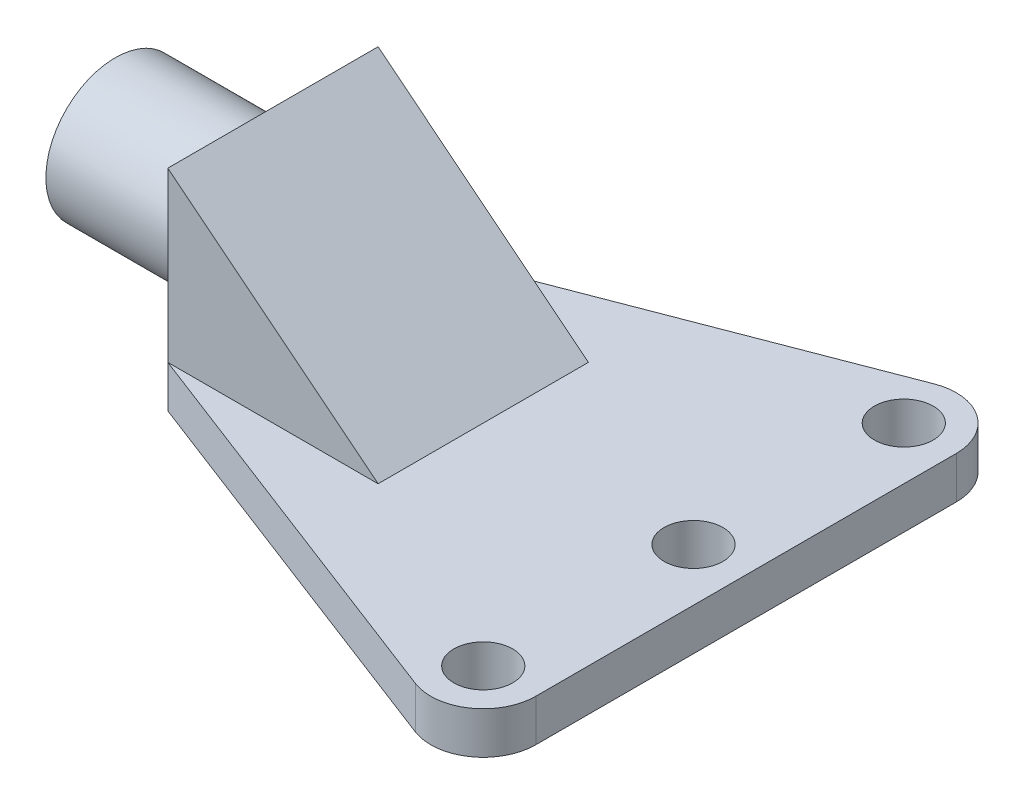
from build123d import *

# Parameters (mm, degrees)
SKETCH2_W           = 25.4
SKETCH2_H           = 25.4
BOSS_EXTRUDE1_DEPTH = 25.4
BOSS_EXTRUDE2_DEPTH = 5.08
SKETCH5_R           = 3.556
CUT_EXTRUDE1_DEPTH  = 5.08
SKETCH6_R           = 3.556
CUT_EXTRUDE2_DEPTH  = 5.08
CUT_EXTRUDE3_DEPTH  = 25.4
SKETCH10_R          = 8.382
BOSS_EXTRUDE3_DEPTH = 19.05
CUT_EXTRUDE4_REACH  = 82.822
SKETCH12_R          = 3.556


with BuildPart() as part:
    # Sketch2 → Boss-Extrude1 (new body)
    with BuildSketch(Plane(origin=(0, 0, 0), x_dir=(1, 0, 0), z_dir=(0, 1, 0))):
        with Locations((-38.1, 0)):
            Rectangle(SKETCH2_W, SKETCH2_H)
    extrude(amount=BOSS_EXTRUDE1_DEPTH)

    # Sketch8 → Cut-Extrude3 (cut)
    with BuildSketch(Plane(origin=(0, 0, -12.7), x_dir=(-1, 0, 0), z_dir=(0, 0, -1))):
        Polygon((50.8, 25.4), (25.4, 5.08), (25.4, 25.4), align=None)
    extrude(amount=-CUT_EXTRUDE3_DEPTH, mode=Mode.SUBTRACT)



with BuildPart() as body_2:
    # Sketch4 → Boss-Extrude2 (new body)
    with BuildSketch(Plane(origin=(0, 0, 0), x_dir=(1, 0, 0), z_dir=(0, 1, 0))):
        with BuildLine():
            Line((-50.8, -12.7), (-2.275658989, -31.327921356))
            ThreePointArc((-2.275658989, -31.327921356), (3.596462869, -30.633003943), (6.349714595, -25.4))
            Line((6.349714595, -25.4), (6.35, 25.4))
            ThreePointArc((6.35, 25.4), (3.596610154, 30.633249029), (-2.275793827, 31.328175306))
            Line((-2.275793827, 31.328175306), (-50.8, 12.7))
            Line((-50.8, 12.7), (-50.8, -12.7))
        make_face()
    extrude(amount=BOSS_EXTRUDE2_DEPTH)

    # Sketch5 → Cut-Extrude1 (cut)
    with BuildSketch(Plane(origin=(0, 0, 0), x_dir=(1, 0, 0), z_dir=(0, 1, 0))):
        with Locations(Location((0, -25.4, 0), (0, 0, 90))):
            Circle(SKETCH5_R)
    extrude(amount=CUT_EXTRUDE1_DEPTH, mode=Mode.SUBTRACT)

    # Sketch6 → Cut-Extrude2 (cut)
    with BuildSketch(Plane(origin=(0, 0, 0), x_dir=(1, 0, 0), z_dir=(0, 1, 0))):
        with Locations(Location((0, 25.4, 0), (0, 0, 90))):
            Circle(SKETCH6_R)
    extrude(amount=CUT_EXTRUDE2_DEPTH, mode=Mode.SUBTRACT)


with BuildPart() as part_1:
    add(part.part)

    add(body_2.part)  # Boss-Extrude3 merges body 2
    # Sketch10 → Boss-Extrude3 (add)
    with BuildSketch(Plane.ZY.offset(50.8)):
        with Locations(Location((0, 12.7, 0), (0, 0, 180))):
            Circle(SKETCH10_R)
    extrude(amount=BOSS_EXTRUDE3_DEPTH)

    # Sketch12 → Cut-Extrude4 (cut, up to next)
    with BuildSketch(Plane(origin=(0, 0, 0), x_dir=(1, 0, 0), z_dir=(0, 1, 0)), mode=Mode.PRIVATE) as cut_extrude4_sk1:
        with Locations(Location((0, 0, 0), (0, 0, 90))):
            Circle(SKETCH12_R)
    cut_extrude4_tool1 = extrude(cut_extrude4_sk1.sketch, amount=CUT_EXTRUDE4_REACH, mode=Mode.PRIVATE) & part_1.part
    add(cut_extrude4_tool1.solids().sort_by_distance((0, 0, 0))[0], mode=Mode.SUBTRACT)


solid = part_1.part
